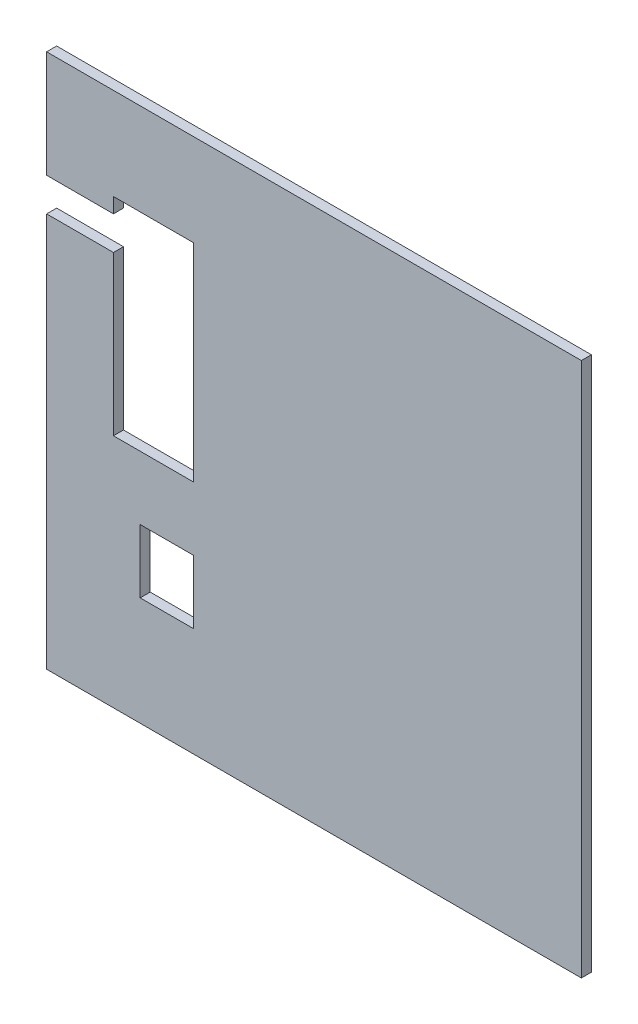
from build123d import *

# Parameters (mm, degrees)
SKETCH1_W           = 16
SKETCH1_H           = 19
BOSS_EXTRUDE1_DEPTH = 3


with BuildPart() as part:
    # Sketch1 → Boss-Extrude1 (new body)
    with BuildSketch(Plane.XY):
        Polygon((-36, -9.5), (-60, -9.5), (-60, 38), (-80, 38), (-80, -80), (80, -80), (80, 80), (-80, 80), (-80, 48), (-60, 48), (-60, 52.5), (-36, 52.5), align=None)
        with Locations((-44, -38)):
            Rectangle(SKETCH1_W, SKETCH1_H, mode=Mode.SUBTRACT)
    extrude(amount=BOSS_EXTRUDE1_DEPTH)


solid = part.part
